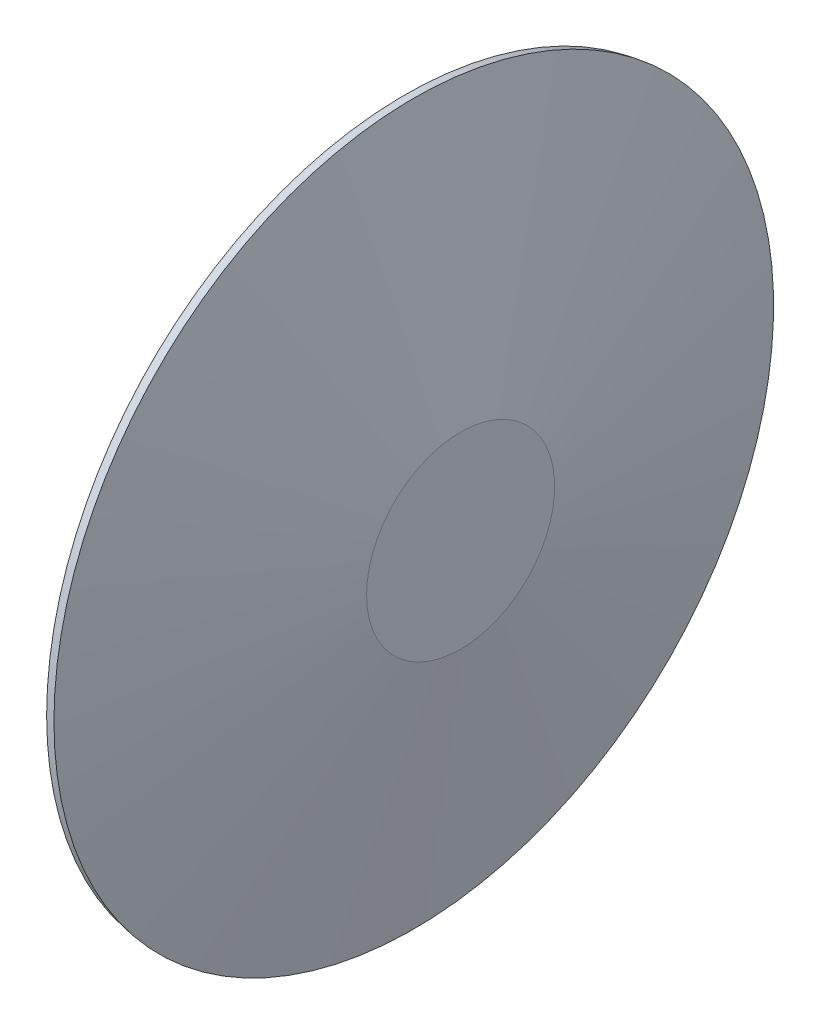
from build123d import *

# Parameters (mm, degrees)
SKETCH_2_R      = 7.5
EXTRUDE_1_DEPTH = 50


with BuildPart() as part:
    # 草图1 → 旋转1 (revolve)
    with BuildSketch(Plane.XY, mode=Mode.PRIVATE) as revolve_1_sk:
        Polygon((0, 0), (0, 20.911534819), (-10.41889066, 80), (-12.388506166, 79.652703645), (-2, 20.736557492), (-2, 0), align=None)
    revolve(revolve_1_sk.sketch.rotate(Axis((-2, 0, 0), (1, 0, 0)), 90), axis=Axis((-2, 0, 0), (1, 0, 0)))

    # 草图2 → 凸台-拉伸1 (add)
    with BuildSketch(Plane.ZY.offset(2)):
        with Locations(Location((0, 0, 0), (0, 0, 180))):
            Circle(SKETCH_2_R)
    extrude(amount=EXTRUDE_1_DEPTH)


solid = part.part
